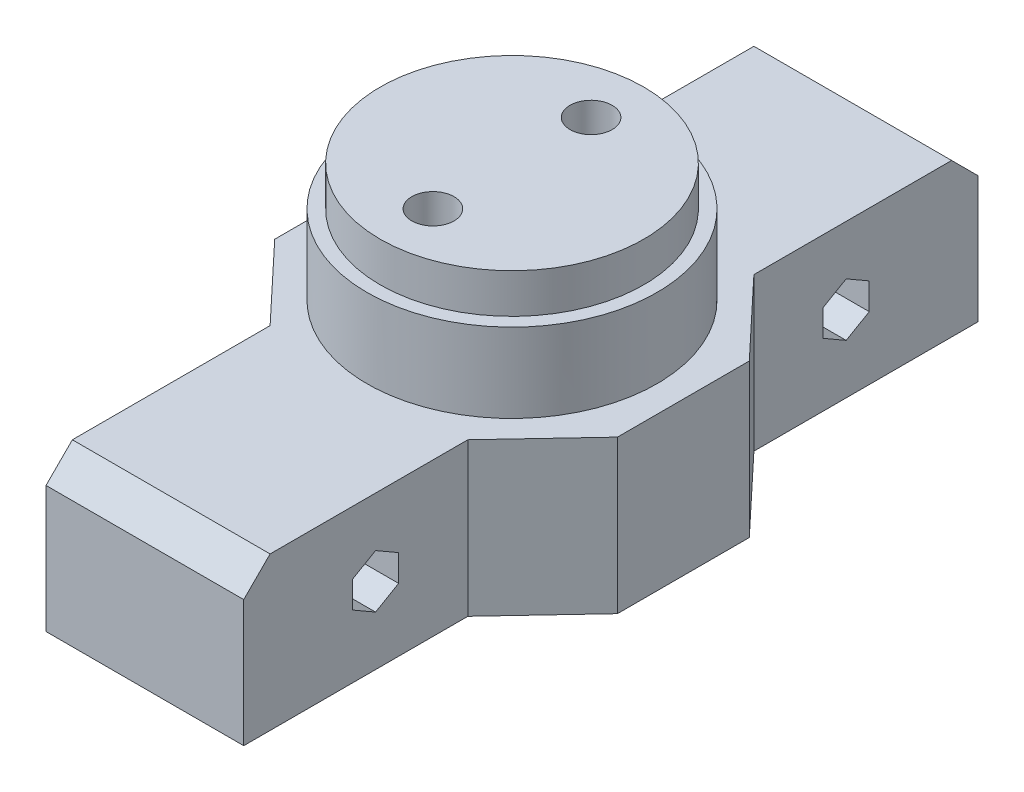
from build123d import *

# Parameters (mm, degrees)
BOSS_EXTRU_1_DEPTH           = 11.6
ESQUISSE2_R                  = 10
BOSS_EXTRU_2_DEPTH           = 9
ENL_V_MAT_EXTRU_1_DEPTH      = 37.999763513
ENL_V_MAT_EXTRU_1_DEPTH_BACK = 37.999763513
ESQUISSE3_R                  = 1.6
ENL_V_MAT_EXTRU_2_DEPTH      = 41.252111746
ENL_V_MAT_EXTRU_2_DEPTH_BACK = 41.252111746
CHANFREIN1_SIZE              = 2
ESQUISSE7_R                  = 11
ESQUISSE7_R_2                = 1.6
BOSS_EXTRU_3_DEPTH           = 6
ENL_V_MAT_EXTRU_3_DEPTH      = 10
R_P_TITION_CIRCULAIRE1_COUNT = 2


with BuildPart() as part:
    # Esquisse1 → Boss.-Extru.1 (new body)
    with BuildSketch(Plane(origin=(0, 0, 0), x_dir=(1, 0, 0), z_dir=(0, 1, 0))):
        Polygon((7.5, 27.85), (-7.5, 27.85), (-7.5, 10.85), (-13, 5), (-13, -5), (-7.5, -10.85), (-7.5, -27.85), (7.5, -27.85), (7.5, -10.85), (13, -5), (13, 5), (7.5, 10.85), align=None)
    extrude(amount=BOSS_EXTRU_1_DEPTH)

    # Esquisse2 → Boss.-Extru.2 (add)
    with BuildSketch(Plane(origin=(0, 11.6, 0), x_dir=(1, 0, 0), z_dir=(0, 1, 0))):
        with Locations(Location((0, 0, 0), (0, 0, 270))):
            Circle(ESQUISSE2_R)
    extrude(amount=BOSS_EXTRU_2_DEPTH)

    # Esquisse3 → Enlèv. mat.-Extru.1 (cut, two sides: drawn at the far end of the back side and taken through both)
    with BuildSketch(Plane.XZ.offset(-ENL_V_MAT_EXTRU_1_DEPTH_BACK)):
        with Locations(Location((0, 6, 0), (0, 0, 270))):
            Circle(ESQUISSE3_R)
        with Locations(Location((0, -6, 0), (0, 0, 270))):
            Circle(ESQUISSE3_R)
    extrude(amount=ENL_V_MAT_EXTRU_1_DEPTH + ENL_V_MAT_EXTRU_1_DEPTH_BACK, mode=Mode.SUBTRACT)

    # Esquisse6 → Enlèv. mat.-Extru.2 (cut, two sides: drawn at the far end of the back side and taken through both)
    with BuildSketch(Plane.ZY.offset(7.5).offset(-ENL_V_MAT_EXTRU_2_DEPTH_BACK)):
        Polygon((16.1, 6.810362971), (17.85, 7.820725942), (19.6, 6.810362971), (19.6, 4.789637029), (17.85, 3.779274058), (16.1, 4.789637029), align=None)
        Polygon((-17.85, 7.820725942), (-19.6, 6.810362971), (-19.6, 4.789637029), (-17.85, 3.779274058), (-16.1, 4.789637029), (-16.1, 6.810362971), align=None)
    extrude(amount=ENL_V_MAT_EXTRU_2_DEPTH + ENL_V_MAT_EXTRU_2_DEPTH_BACK, mode=Mode.SUBTRACT)

    # Chanfrein1
    chanfrein1_edges = [part.edges().sort_by_distance(p)[0] for p in [
        (0, 11.6, 27.85),
        (0, 11.6, -27.85),
    ]]
    chamfer(chanfrein1_edges, length=CHANFREIN1_SIZE)

    # Esquisse7 → Boss.-Extru.3 (add)
    with BuildSketch(Plane(origin=(0, 11.6, 0), x_dir=(1, 0, 0), z_dir=(0, 1, 0))):
        with Locations(Location((0, 0, 0), (0, 0, 90))):
            Circle(ESQUISSE7_R)
        with Locations(Location((0, 6, 0), (0, 0, 90))):
            Circle(ESQUISSE7_R_2, mode=Mode.SUBTRACT)
        with Locations(Location((0, -6, 0), (0, 0, 90))):
            Circle(ESQUISSE7_R_2, mode=Mode.SUBTRACT)
    extrude(amount=BOSS_EXTRU_3_DEPTH)

    # Esquisse8 → Enlèv. mat.-Extru.3 (cut)
    with BuildSketch(Plane.XZ):
        Polygon((0, 9.233161507), (-2.8, 7.616580754), (-2.8, 4.383419246), (0, 2.766838493), (2.8, 4.383419246), (2.8, 7.616580754), align=None)
    enl_v_mat_extru_3 = extrude(amount=-ENL_V_MAT_EXTRU_3_DEPTH, mode=Mode.SUBTRACT)

    # Répétition circulaire1: Enlèv. mat.-Extru.3 ×2 about axis
    r_p_tition_circulaire1_axis = Axis((0, 0, 0), (0, 1, 0))
    for i in range(1, R_P_TITION_CIRCULAIRE1_COUNT):
        add(enl_v_mat_extru_3.rotate(r_p_tition_circulaire1_axis, i * 360 / R_P_TITION_CIRCULAIRE1_COUNT), mode=Mode.SUBTRACT)


solid = part.part
